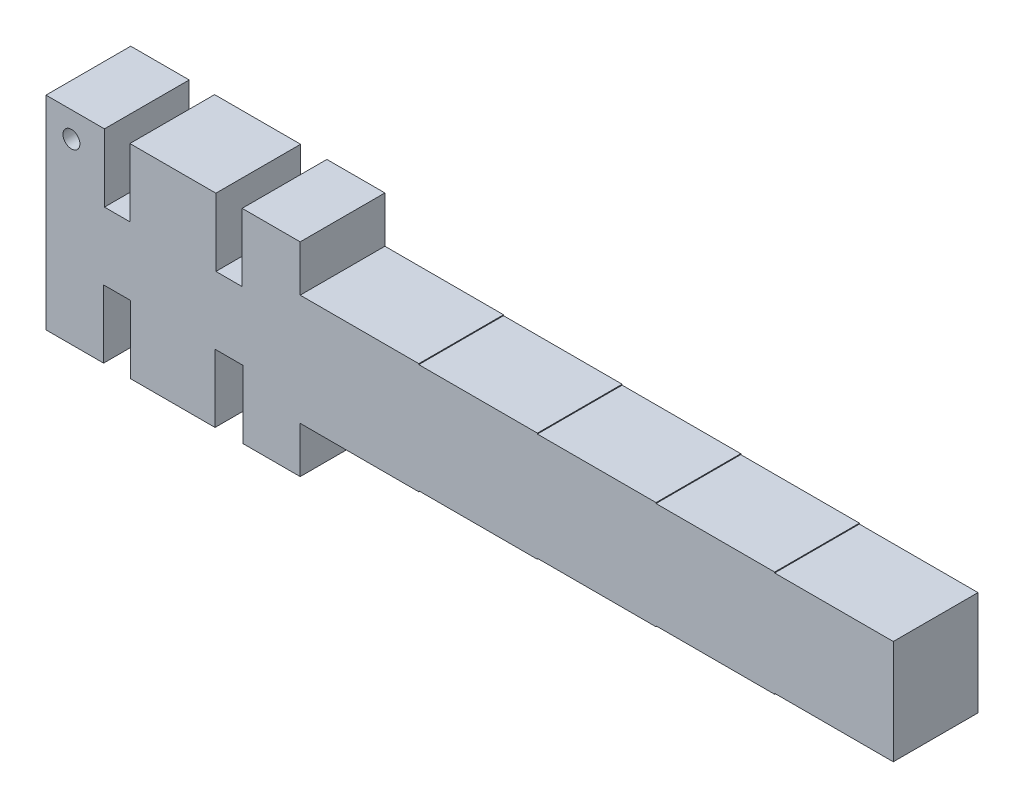
from build123d import *

# Parameters (mm, degrees)
GAUGE_BODY_DEPTH   = 5
NOTCH_3_0_SKETCH_W = 3
NOTCH_3_0_SKETCH_H = 9
NOTCH_3_0_DEPTH    = 6
NOTCH_3_1_SKETCH_W = 3.1
NOTCH_3_1_SKETCH_H = 9
NOTCH_3_1_DEPTH    = 6
NOTCH_3_2_SKETCH_W = 3.2
NOTCH_3_2_SKETCH_H = 9
NOTCH_3_2_DEPTH    = 6
NOTCH_3_3_SKETCH_W = 3.3
NOTCH_3_3_SKETCH_H = 9
NOTCH_3_3_DEPTH    = 6
MARK_HOLE_SKETCH_R = 1
MARK_HOLE_DEPTH    = 6


with BuildPart() as part:
    # gauge body sketch → gauge body (new, symmetric)
    with BuildSketch(Plane.XY.offset(5)):
        Polygon((-30, 12), (0, 12), (0, 6.55), (14, 6.55), (14, 6.45), (28, 6.45), (28, 6.35), (42, 6.35), (42, 6.25), (56, 6.25), (56, 6.15), (70, 6.15), (70, -6.15), (56, -6.15), (56, -6.25), (42, -6.25), (42, -6.35), (28, -6.35), (28, -6.45), (14, -6.45), (14, -6.55), (0, -6.55), (0, -12), (-30, -12), align=None)
    extrude(amount=GAUGE_BODY_DEPTH, both=True)

    # notch 3.0 sketch → notch 3.0 (cut, symmetric)
    with BuildSketch(Plane.XY.offset(5)):
        with Locations((-21.6, 8.5)):
            Rectangle(NOTCH_3_0_SKETCH_W, NOTCH_3_0_SKETCH_H)
    extrude(amount=NOTCH_3_0_DEPTH, both=True, mode=Mode.SUBTRACT)

    # notch 3.1 sketch → notch 3.1 (cut, symmetric)
    with BuildSketch(Plane.XY.offset(5)):
        with Locations((-8.4, 8.5)):
            Rectangle(NOTCH_3_1_SKETCH_W, NOTCH_3_1_SKETCH_H)
    extrude(amount=NOTCH_3_1_DEPTH, both=True, mode=Mode.SUBTRACT)

    # notch 3.2 sketch → notch 3.2 (cut, symmetric)
    with BuildSketch(Plane.XY.offset(5)):
        with Locations((-21.6, -8.5)):
            Rectangle(NOTCH_3_2_SKETCH_W, NOTCH_3_2_SKETCH_H)
    extrude(amount=NOTCH_3_2_DEPTH, both=True, mode=Mode.SUBTRACT)

    # notch 3.3 sketch → notch 3.3 (cut, symmetric)
    with BuildSketch(Plane.XY.offset(5)):
        with Locations((-8.4, -8.5)):
            Rectangle(NOTCH_3_3_SKETCH_W, NOTCH_3_3_SKETCH_H)
    extrude(amount=NOTCH_3_3_DEPTH, both=True, mode=Mode.SUBTRACT)

    # mark hole sketch → mark hole (cut, symmetric)
    with BuildSketch(Plane.XY.offset(5)):
        with Locations(Location((-27, 9, 0), (0, 0, 180))):
            Circle(MARK_HOLE_SKETCH_R)
    extrude(amount=MARK_HOLE_DEPTH, both=True, mode=Mode.SUBTRACT)


solid = part.part
